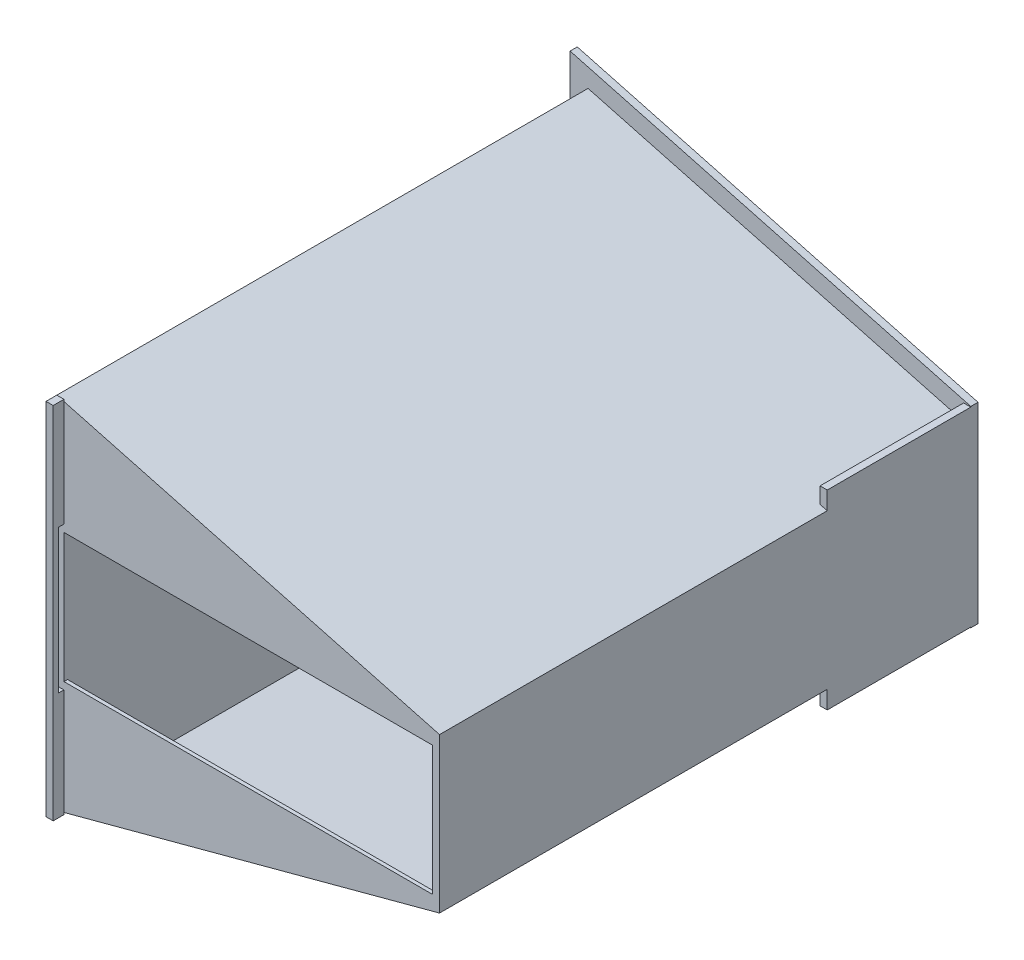
from build123d import *

# Parameters (mm, degrees)
BOSS_EXTRUDE1_DEPTH   = 150
BOSS_EXTRUDE3_DEPTH   = 1
BOSS_EXTRUDE3_2_DEPTH = 1
BOSS_EXTRUDE5_DEPTH   = 2
BOSS_EXTRUDE6_DEPTH   = 2
SKETCH8_W             = 40
SKETCH8_H             = 5
BOSS_EXTRUDE7_DEPTH   = 2


with BuildPart() as part:
    # Sketch1 → Boss-Extrude1 (new body)
    with BuildSketch(Plane.XY):
        Polygon((104.63, 25.965351431), (104.63, 69.034648569), (-2, 97.60645993), (-2, -2.60645993), align=None)
        Polygon((102.63, 67.5), (0, 95), (0, 0), (102.63, 27.5), align=None, mode=Mode.SUBTRACT)
    extrude(amount=BOSS_EXTRUDE1_DEPTH)



with BuildPart() as body_2:
    # Sketch3 → Boss-Extrude3 (new body)
    with BuildSketch(Plane.XY.offset(150)):
        Polygon((0, 65.5), (102.63, 65.5), (102.63, 67.5), (0, 95), align=None)
    extrude(amount=-BOSS_EXTRUDE3_DEPTH)


with BuildPart() as body_3:
    # Sketch3 → Boss-Extrude3 2 (new body)
    with BuildSketch(Plane.XY.offset(150)):
        Polygon((102.63, 27.5), (102.63, 29.5), (0, 29.5), (0, 0), align=None)
    extrude(amount=-BOSS_EXTRUDE3_2_DEPTH)


with BuildPart() as part_1:
    add(part.part)

    add(body_2.part)  # Boss-Extrude5 merges body 2

    add(body_3.part)  # Boss-Extrude5 merges body 3
    # Sketch6 → Boss-Extrude5 (add)
    with BuildSketch(Plane.ZY.offset(2)):
        Polygon((150, 67.5), (151.5, 67.5), (151.5, 27.5), (150, 27.5), (150, -2.60645993), (153, -2.60645993), (153, 97.60645993), (150, 97.60645993), align=None)
    extrude(amount=-BOSS_EXTRUDE5_DEPTH)

    # Sketch7 → Boss-Extrude6 (add)
    with BuildSketch(Plane(origin=(0, 0, 0), x_dir=(-1, 0, 0), z_dir=(0, 0, -1))):
        Polygon((-104.63, 20.788965809), (7, -9.122609754), (7, 104.122609754), (-104.63, 74.211034191), (-104.63, 69.034648569), (2, 97.60645993), (2, -2.60645993), (-104.63, 25.965351431), align=None)
    extrude(amount=-BOSS_EXTRUDE6_DEPTH)

    # Sketch8 → Boss-Extrude7 (add)
    with BuildSketch(Plane(origin=(104.63, 0, 0), x_dir=(0, 0, -1), z_dir=(1, 0, 0))):
        with Locations((-22, 71.534648569)):
            Rectangle(SKETCH8_W, SKETCH8_H)
        with Locations((-22, 23.465351431)):
            Rectangle(SKETCH8_W, SKETCH8_H)
    extrude(amount=-BOSS_EXTRUDE7_DEPTH)


solid = part_1.part
